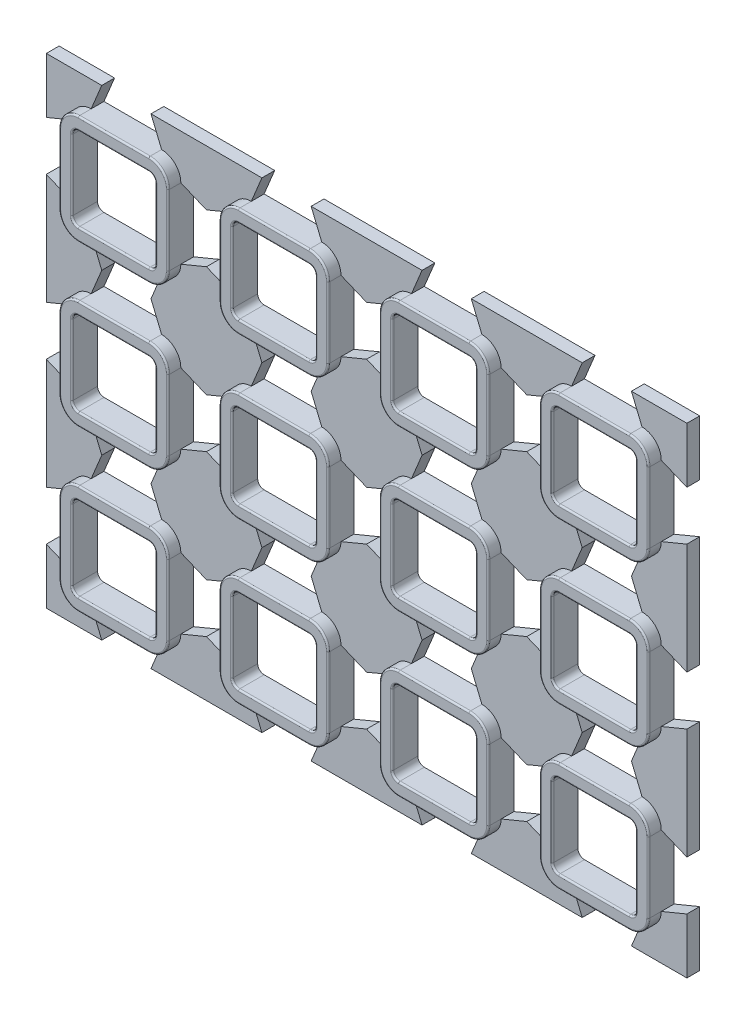
from build123d import *

# Parameters (mm, degrees)
SKIZZE1_W                         = 75
SKIZZE1_H                         = 100
AUFSATZ_LINEAR_AUSTRAGEN1_DEPTH   = 2
SCHNITT_LINEAR_AUSTRAGEN1_DEPTH   = 126.015998976
AUFSATZ_LINEAR_START              = 2
AUFSATZ_LINEAR_AUSTRAGEN2_DEPTH   = 2
VERRUNDUNG1_R                     = 0.25
LINEARES_MUSTER1_COUNT            = 4
LINEARES_MUSTER1_PITCH            = 25
LINEARES_MUSTER1_COUNT_DIR2       = 3
LINEARES_MUSTER1_PITCH_DIR2       = 25
VERRUNDUNG1_OF_LINEARES_MUSTER1_R = 0.25


with BuildPart() as part:
    # Skizze1 → Aufsatz-Linear austragen1 (new body)
    with BuildSketch(Plane(origin=(0, 0, 0), x_dir=(0, 1, 0), z_dir=(0, 0, 1))):
        with Locations((37.5, 50)):
            Rectangle(SKIZZE1_W, SKIZZE1_H)
    extrude(amount=AUFSATZ_LINEAR_AUSTRAGEN1_DEPTH)

    # Skizze2 → Schnitt-Linear austragen1 (cut, through all)
    with BuildSketch(Plane.XY.offset(2)):
        Polygon((-79, 18), (-79, 7), (-75, 8.656854249), (-75, 16.343145751), align=None)
        Polygon((-83.656854249, 0), (-82, 4), (-93, 4), (-91.343145751, 0), align=None)
        Polygon((-93, 21), (-82, 21), (-83.656854249, 25), (-91.343145751, 25), align=None)
        Polygon((-100, 8.656854249), (-96, 7), (-96, 18), (-100, 16.343145751), align=None)
        with BuildLine():
            ThreePointArc((-82, 6), (-81.292893219, 6.292893219), (-81, 7))
            Line((-81, 7), (-81, 18))
            ThreePointArc((-81, 18), (-81.292893219, 18.707106781), (-82, 19))
            Line((-82, 19), (-93, 19))
            ThreePointArc((-93, 19), (-93.707106781, 18.707106781), (-94, 18))
            Line((-94, 18), (-94, 7))
            ThreePointArc((-94, 7), (-93.707106781, 6.292893219), (-93, 6))
            Line((-93, 6), (-82, 6))
        make_face()
    schnitt_linear_austragen1 = extrude(amount=-SCHNITT_LINEAR_AUSTRAGEN1_DEPTH, mode=Mode.SUBTRACT)

    # Skizze2<5> → Aufsatz-Linear austragen2 (add)
    with BuildSketch(Plane.XY.offset(2).offset(AUFSATZ_LINEAR_START)):
        with BuildLine():
            ThreePointArc((-82, 4), (-79.878679656, 4.878679656), (-79, 7))
            Line((-79, 7), (-79, 18))
            ThreePointArc((-79, 18), (-79.878679656, 20.121320344), (-82, 21))
            Line((-82, 21), (-93, 21))
            ThreePointArc((-93, 21), (-95.121320344, 20.121320344), (-96, 18))
            Line((-96, 18), (-96, 7))
            ThreePointArc((-96, 7), (-95.121320344, 4.878679656), (-93, 4))
            Line((-93, 4), (-82, 4))
        make_face()
        with BuildLine():
            Line((-81, 18), (-81, 7))
            ThreePointArc((-81, 7), (-81.292893219, 6.292893219), (-82, 6))
            Line((-82, 6), (-93, 6))
            ThreePointArc((-93, 6), (-93.707106781, 6.292893219), (-94, 7))
            Line((-94, 7), (-94, 18))
            ThreePointArc((-94, 18), (-93.707106781, 18.707106781), (-93, 19))
            Line((-93, 19), (-82, 19))
            ThreePointArc((-82, 19), (-81.292893219, 18.707106781), (-81, 18))
        make_face(mode=Mode.SUBTRACT)
    aufsatz_linear_austragen2 = extrude(amount=-AUFSATZ_LINEAR_AUSTRAGEN2_DEPTH)

    # Verrundung1
    verrundung1_edges = [part.edges().sort_by_distance(p)[0] for p in [
        (-81.292893219, 18.707106781, 4),
        (-87.5, 19, 4),
        (-93.707106781, 18.707106781, 4),
        (-94, 12.5, 4),
        (-93.707106781, 6.292893219, 4),
        (-87.5, 6, 4),
        (-81.292893219, 6.292893219, 4),
        (-81, 12.5, 4),
        (-79.878679656, 4.878679656, 4),
        (-87.5, 4, 4),
        (-95.121320344, 4.878679656, 4),
        (-96, 12.5, 4),
        (-95.121320344, 20.121320344, 4),
        (-87.5, 21, 4),
        (-79.878679656, 20.121320344, 4),
        (-79, 12.5, 4),
    ]]
    fillet(verrundung1_edges, radius=VERRUNDUNG1_R)

    # Lineares Muster1: Schnitt-Linear austragen1, Aufsatz-Linear austragen2 4 × 3
    with Locations(*[(i * LINEARES_MUSTER1_PITCH, j * LINEARES_MUSTER1_PITCH_DIR2, 0) for i in range(LINEARES_MUSTER1_COUNT) for j in range(LINEARES_MUSTER1_COUNT_DIR2) if (i, j) != (0, 0)]):
        add(schnitt_linear_austragen1, mode=Mode.SUBTRACT)
        add(aufsatz_linear_austragen2)

    # Verrundung1 of Lineares Muster1
    verrundung1_of_lineares_muster1_edges = [part.edges().sort_by_distance(p)[0] for p in [
        (-81.292893219, 43.707106781, 4),
        (-87.5, 44, 4),
        (-93.707106781, 43.707106781, 4),
        (-94, 37.5, 4),
        (-93.707106781, 31.292893219, 4),
        (-87.5, 31, 4),
        (-81.292893219, 31.292893219, 4),
        (-81, 37.5, 4),
        (-79.878679656, 29.878679656, 4),
        (-87.5, 29, 4),
        (-95.121320344, 29.878679656, 4),
        (-96, 37.5, 4),
        (-95.121320344, 45.121320344, 4),
        (-87.5, 46, 4),
        (-79.878679656, 45.121320344, 4),
        (-79, 37.5, 4),
        (-81.292893219, 68.707106781, 4),
        (-87.5, 69, 4),
        (-93.707106781, 68.707106781, 4),
        (-94, 62.5, 4),
        (-93.707106781, 56.292893219, 4),
        (-87.5, 56, 4),
        (-81.292893219, 56.292893219, 4),
        (-81, 62.5, 4),
        (-79.878679656, 54.878679656, 4),
        (-87.5, 54, 4),
        (-95.121320344, 54.878679656, 4),
        (-96, 62.5, 4),
        (-95.121320344, 70.121320344, 4),
        (-87.5, 71, 4),
        (-79.878679656, 70.121320344, 4),
        (-79, 62.5, 4),
        (-56.292893219, 18.707106781, 4),
        (-62.5, 19, 4),
        (-68.707106781, 18.707106781, 4),
        (-69, 12.5, 4),
        (-68.707106781, 6.292893219, 4),
        (-62.5, 6, 4),
        (-56.292893219, 6.292893219, 4),
        (-56, 12.5, 4),
        (-54.878679656, 4.878679656, 4),
        (-62.5, 4, 4),
        (-70.121320344, 4.878679656, 4),
        (-71, 12.5, 4),
        (-70.121320344, 20.121320344, 4),
        (-62.5, 21, 4),
        (-54.878679656, 20.121320344, 4),
        (-54, 12.5, 4),
        (-56.292893219, 43.707106781, 4),
        (-62.5, 44, 4),
        (-68.707106781, 43.707106781, 4),
        (-69, 37.5, 4),
        (-68.707106781, 31.292893219, 4),
        (-62.5, 31, 4),
        (-56.292893219, 31.292893219, 4),
        (-56, 37.5, 4),
        (-54.878679656, 29.878679656, 4),
        (-62.5, 29, 4),
        (-70.121320344, 29.878679656, 4),
        (-71, 37.5, 4),
        (-70.121320344, 45.121320344, 4),
        (-62.5, 46, 4),
        (-54.878679656, 45.121320344, 4),
        (-54, 37.5, 4),
        (-56.292893219, 68.707106781, 4),
        (-62.5, 69, 4),
        (-68.707106781, 68.707106781, 4),
        (-69, 62.5, 4),
        (-68.707106781, 56.292893219, 4),
        (-62.5, 56, 4),
        (-56.292893219, 56.292893219, 4),
        (-56, 62.5, 4),
        (-54.878679656, 54.878679656, 4),
        (-62.5, 54, 4),
        (-70.121320344, 54.878679656, 4),
        (-71, 62.5, 4),
        (-70.121320344, 70.121320344, 4),
        (-62.5, 71, 4),
        (-54.878679656, 70.121320344, 4),
        (-54, 62.5, 4),
        (-31.292893219, 18.707106781, 4),
        (-37.5, 19, 4),
        (-43.707106781, 18.707106781, 4),
        (-44, 12.5, 4),
        (-43.707106781, 6.292893219, 4),
        (-37.5, 6, 4),
        (-31.292893219, 6.292893219, 4),
        (-31, 12.5, 4),
        (-29.878679656, 4.878679656, 4),
        (-37.5, 4, 4),
        (-45.121320344, 4.878679656, 4),
        (-46, 12.5, 4),
        (-45.121320344, 20.121320344, 4),
        (-37.5, 21, 4),
        (-29.878679656, 20.121320344, 4),
        (-29, 12.5, 4),
        (-31.292893219, 43.707106781, 4),
        (-37.5, 44, 4),
        (-43.707106781, 43.707106781, 4),
        (-44, 37.5, 4),
        (-43.707106781, 31.292893219, 4),
        (-37.5, 31, 4),
        (-31.292893219, 31.292893219, 4),
        (-31, 37.5, 4),
        (-29.878679656, 29.878679656, 4),
        (-37.5, 29, 4),
        (-45.121320344, 29.878679656, 4),
        (-46, 37.5, 4),
        (-45.121320344, 45.121320344, 4),
        (-37.5, 46, 4),
        (-29.878679656, 45.121320344, 4),
        (-29, 37.5, 4),
        (-31.292893219, 68.707106781, 4),
        (-37.5, 69, 4),
        (-43.707106781, 68.707106781, 4),
        (-44, 62.5, 4),
        (-43.707106781, 56.292893219, 4),
        (-37.5, 56, 4),
        (-31.292893219, 56.292893219, 4),
        (-31, 62.5, 4),
        (-29.878679656, 54.878679656, 4),
        (-37.5, 54, 4),
        (-45.121320344, 54.878679656, 4),
        (-46, 62.5, 4),
        (-45.121320344, 70.121320344, 4),
        (-37.5, 71, 4),
        (-29.878679656, 70.121320344, 4),
        (-29, 62.5, 4),
        (-6.292893219, 18.707106781, 4),
        (-12.5, 19, 4),
        (-18.707106781, 18.707106781, 4),
        (-19, 12.5, 4),
        (-18.707106781, 6.292893219, 4),
        (-12.5, 6, 4),
        (-6.292893219, 6.292893219, 4),
        (-6, 12.5, 4),
        (-4.878679656, 4.878679656, 4),
        (-12.5, 4, 4),
        (-20.121320344, 4.878679656, 4),
        (-21, 12.5, 4),
        (-20.121320344, 20.121320344, 4),
        (-12.5, 21, 4),
        (-4.878679656, 20.121320344, 4),
        (-4, 12.5, 4),
        (-6.292893219, 43.707106781, 4),
        (-12.5, 44, 4),
        (-18.707106781, 43.707106781, 4),
        (-19, 37.5, 4),
        (-18.707106781, 31.292893219, 4),
        (-12.5, 31, 4),
        (-6.292893219, 31.292893219, 4),
        (-6, 37.5, 4),
        (-4.878679656, 29.878679656, 4),
        (-12.5, 29, 4),
        (-20.121320344, 29.878679656, 4),
        (-21, 37.5, 4),
        (-20.121320344, 45.121320344, 4),
        (-12.5, 46, 4),
        (-4.878679656, 45.121320344, 4),
        (-4, 37.5, 4),
        (-6.292893219, 68.707106781, 4),
        (-12.5, 69, 4),
        (-18.707106781, 68.707106781, 4),
        (-19, 62.5, 4),
        (-18.707106781, 56.292893219, 4),
        (-12.5, 56, 4),
        (-6.292893219, 56.292893219, 4),
        (-6, 62.5, 4),
        (-4.878679656, 54.878679656, 4),
        (-12.5, 54, 4),
        (-20.121320344, 54.878679656, 4),
        (-21, 62.5, 4),
        (-20.121320344, 70.121320344, 4),
        (-12.5, 71, 4),
        (-4.878679656, 70.121320344, 4),
        (-4, 62.5, 4),
    ]]
    fillet(verrundung1_of_lineares_muster1_edges, radius=VERRUNDUNG1_OF_LINEARES_MUSTER1_R)


solid = part.part
